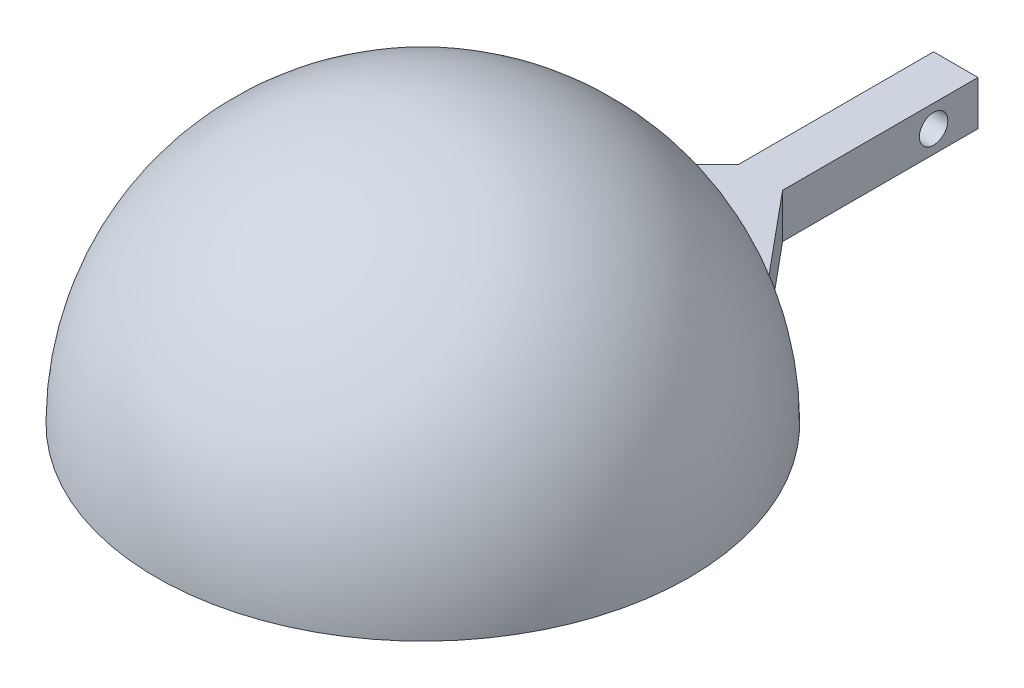
from build123d import *

# Parameters (mm, degrees)
SKETCH3_W           = 5
SKETCH3_H           = 30
BOSS_EXTRUDE1_DEPTH = 5
SKETCH4_R           = 1.6
CUT_EXTRUDE1_DEPTH  = 75.540257579


with BuildPart() as part:
    # Sketch2 → Revolve1 (revolve)
    with BuildSketch(Plane.XY):
        with BuildLine():
            Line((0, 29), (0, 30))
            ThreePointArc((0, 30), (21.213203436, 21.213203436), (30, 0))
            Line((30, 0), (29, 0))
            ThreePointArc((29, 0), (20.506096654, 20.506096654), (0, 29))
        make_face()
    revolve(axis=Axis((0, 0, 0), (0, 1, 0)))

    # Sketch3 → Boss-Extrude1 (add)
    with BuildSketch(Plane.XZ):
        with Locations((0, -45)):
            Rectangle(SKETCH3_W, SKETCH3_H)
        with BuildLine():
            Line((-2.5, -38), (2.5, -38))
            Line((2.5, -38), (12.22277757, -26.308006594))
            Line((12.22277757, -26.308006594), (12.219091313, -26.300072385))
            ThreePointArc((12.219091313, -26.300072385), (-0.967100454, -29.109666297), (-13.937737405, -25.431073041))
            Line((-13.937737405, -25.431073041), (-14.41834904, -26.308006594))
            Line((-14.41834904, -26.308006594), (-2.5, -38))
        make_face()
    extrude(amount=-BOSS_EXTRUDE1_DEPTH)

    # Sketch4 → Cut-Extrude1 (cut, through all)
    with BuildSketch(Plane(origin=(2.5, 0, 0), x_dir=(0, 0, -1), z_dir=(1, 0, 0))):
        with Locations((55, 2.5)):
            Circle(SKETCH4_R)
    extrude(amount=-CUT_EXTRUDE1_DEPTH, mode=Mode.SUBTRACT)


solid = part.part
